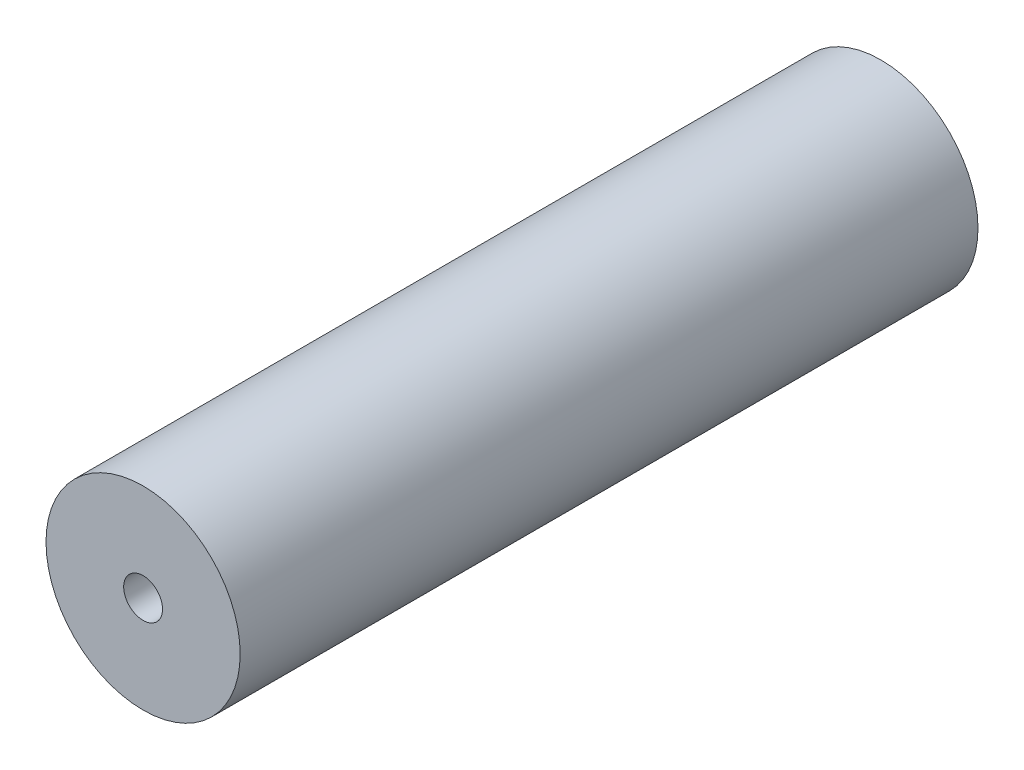
from build123d import *

# Parameters (mm, degrees)
ESQUISSE1_R        = 25
ESQUISSE1_R_2      = 5
BOSS_EXTRU_1_DEPTH = 190


with BuildPart() as part:
    # Esquisse1 → Boss.-Extru.1 (new body)
    with BuildSketch(Plane.XY):
        Circle(ESQUISSE1_R)
        Circle(ESQUISSE1_R_2, mode=Mode.SUBTRACT)
    extrude(amount=BOSS_EXTRU_1_DEPTH)


solid = part.part
